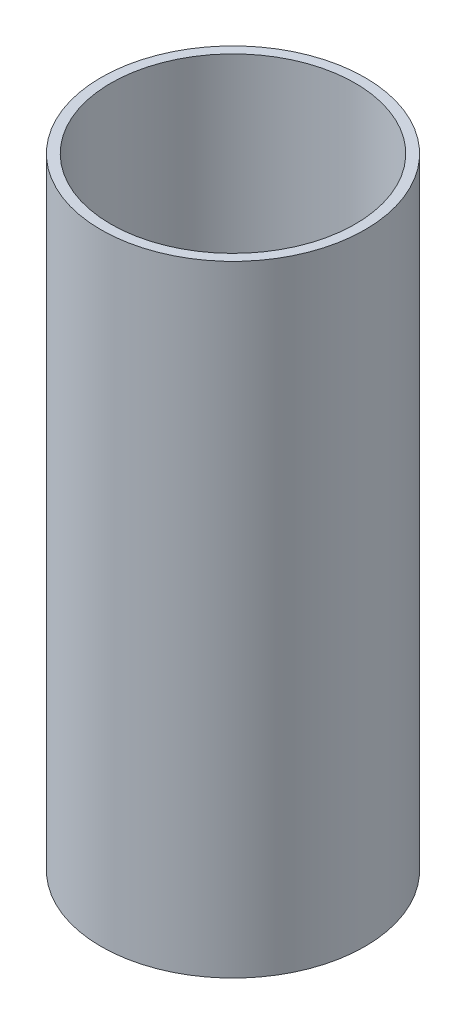
from build123d import *

# Parameters (mm, degrees)
SKETCH2_R           = 54
SKETCH2_R_2         = 50
BOSS_EXTRUDE1_DEPTH = 254


with BuildPart() as part:
    # Sketch2 → Boss-Extrude1 (new body)
    with BuildSketch(Plane(origin=(0, 0, 0), x_dir=(1, 0, 0), z_dir=(0, 1, 0))):
        with Locations(Location((0, 0, 0), (0, 0, 270))):
            Circle(SKETCH2_R)
        with Locations(Location((0, 0, 0), (0, 0, 270))):
            Circle(SKETCH2_R_2, mode=Mode.SUBTRACT)
    extrude(amount=BOSS_EXTRUDE1_DEPTH)


solid = part.part
